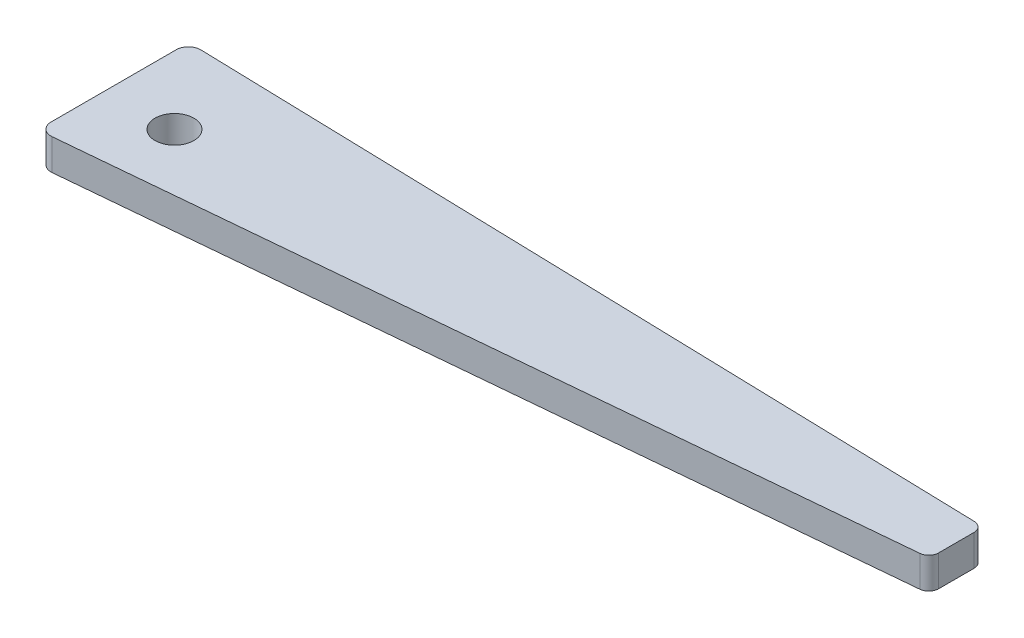
from build123d import *

# Parameters (mm, degrees)
BOSS_EXTRUDE1_DEPTH = 1.6
SKETCH2_R           = 1
CUT_EXTRUDE1_DEPTH  = 43.739606023


with BuildPart() as part:
    # Sketch1 → Boss-Extrude1 (new body)
    with BuildSketch(Plane(origin=(0, 0, 0), x_dir=(1, 0, 0), z_dir=(0, 1, 0))):
        with BuildLine():
            Line((0.687764733, 0.063233761), (41.545777414, 3.819759331))
            ThreePointArc((41.545777414, 3.819759331), (41.869383748, 3.980679162), (42, 4.317659349))
            Line((42, 4.317659349), (42, 6.139996118))
            ThreePointArc((42, 6.139996118), (41.858334981, 6.488702357), (41.513615834, 6.639810692))
            Line((41.513615834, 6.639810692), (0.647236122, 7.753083238))
            ThreePointArc((0.647236122, 7.753083238), (0.190653754, 7.574796866), (0, 7.123238858))
            Line((0, 7.123238858), (0, 0.690665502))
            ThreePointArc((0, 0.690665502), (0.20543041, 0.225184322), (0.687764733, 0.063233761))
        make_face()
    extrude(amount=BOSS_EXTRUDE1_DEPTH)

    # Sketch2 → Cut-Extrude1 (cut, through all)
    with BuildSketch(Plane(origin=(0, 1.6, 0), x_dir=(1, 0, 0), z_dir=(0, 1, 0))):
        with Locations(Location((3.5, 3.535289983, 0), (0, 0, 270))):
            Circle(SKETCH2_R)
    extrude(amount=-CUT_EXTRUDE1_DEPTH, mode=Mode.SUBTRACT)


solid = part.part
